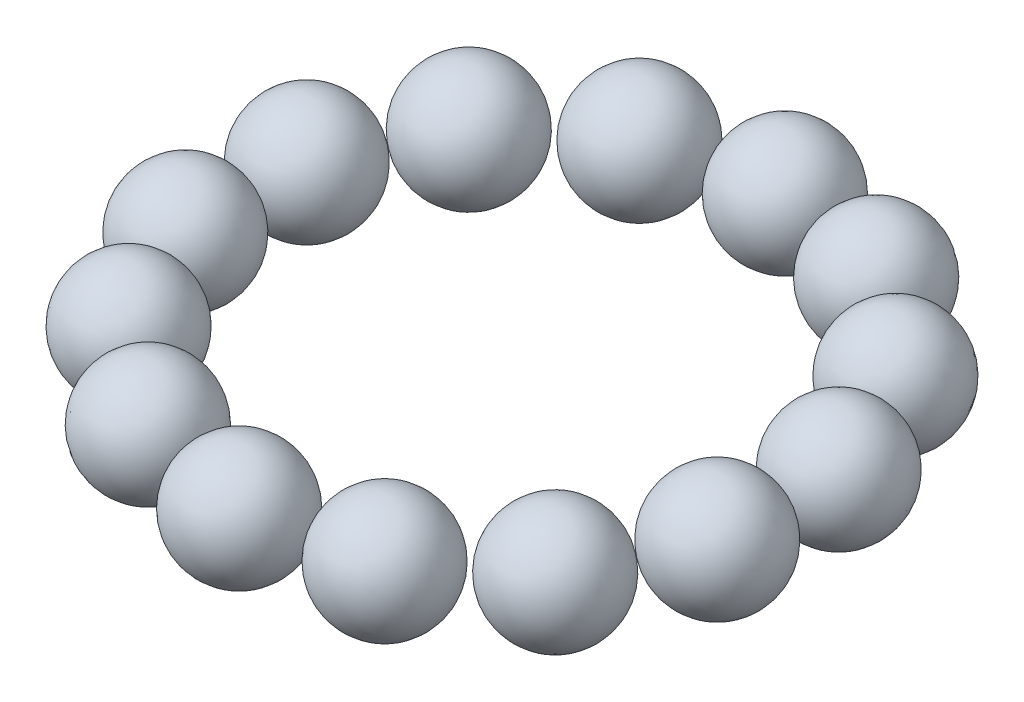
from build123d import *

# Parameters (mm, degrees)
CIRPATTERN2_COUNT = 14


with BuildPart() as part:
    # Sketch2 → Revolve1 (revolve)
    with BuildSketch(Plane.YZ):
        with BuildLine():
            ThreePointArc((3, 14), (0, 17), (-3, 14))
            Line((-3, 14), (3, 14))
        make_face()
    revolve(axis=Axis((0, -3, 14), (0, 1, 0)))


with BuildPart() as cirpattern2_1:
    # CirPattern2: pattern copy
    add(part.part.rotate(Axis((0, -31.815276748, 0), (0, 1, 0)), 1 * 360 / CIRPATTERN2_COUNT))


with BuildPart() as cirpattern2_2:
    # CirPattern2: pattern copy
    add(part.part.rotate(Axis((0, -31.815276748, 0), (0, 1, 0)), 2 * 360 / CIRPATTERN2_COUNT))


with BuildPart() as cirpattern2_3:
    # CirPattern2: pattern copy
    add(part.part.rotate(Axis((0, -31.815276748, 0), (0, 1, 0)), 3 * 360 / CIRPATTERN2_COUNT))


with BuildPart() as cirpattern2_4:
    # CirPattern2: pattern copy
    add(part.part.rotate(Axis((0, -31.815276748, 0), (0, 1, 0)), 4 * 360 / CIRPATTERN2_COUNT))


with BuildPart() as cirpattern2_5:
    # CirPattern2: pattern copy
    add(part.part.rotate(Axis((0, -31.815276748, 0), (0, 1, 0)), 5 * 360 / CIRPATTERN2_COUNT))


with BuildPart() as cirpattern2_6:
    # CirPattern2: pattern copy
    add(part.part.rotate(Axis((0, -31.815276748, 0), (0, 1, 0)), 6 * 360 / CIRPATTERN2_COUNT))


with BuildPart() as cirpattern2_7:
    # CirPattern2: pattern copy
    add(part.part.rotate(Axis((0, -31.815276748, 0), (0, 1, 0)), 7 * 360 / CIRPATTERN2_COUNT))


with BuildPart() as cirpattern2_8:
    # CirPattern2: pattern copy
    add(part.part.rotate(Axis((0, -31.815276748, 0), (0, 1, 0)), 8 * 360 / CIRPATTERN2_COUNT))


with BuildPart() as cirpattern2_9:
    # CirPattern2: pattern copy
    add(part.part.rotate(Axis((0, -31.815276748, 0), (0, 1, 0)), 9 * 360 / CIRPATTERN2_COUNT))


with BuildPart() as cirpattern2_10:
    # CirPattern2: pattern copy
    add(part.part.rotate(Axis((0, -31.815276748, 0), (0, 1, 0)), 10 * 360 / CIRPATTERN2_COUNT))


with BuildPart() as cirpattern2_11:
    # CirPattern2: pattern copy
    add(part.part.rotate(Axis((0, -31.815276748, 0), (0, 1, 0)), 11 * 360 / CIRPATTERN2_COUNT))


with BuildPart() as cirpattern2_12:
    # CirPattern2: pattern copy
    add(part.part.rotate(Axis((0, -31.815276748, 0), (0, 1, 0)), 12 * 360 / CIRPATTERN2_COUNT))


with BuildPart() as cirpattern2_13:
    # CirPattern2: pattern copy
    add(part.part.rotate(Axis((0, -31.815276748, 0), (0, 1, 0)), 13 * 360 / CIRPATTERN2_COUNT))


solid = Compound([part.part, cirpattern2_1.part, cirpattern2_2.part, cirpattern2_3.part, cirpattern2_4.part, cirpattern2_5.part, cirpattern2_6.part, cirpattern2_7.part, cirpattern2_8.part, cirpattern2_9.part, cirpattern2_10.part, cirpattern2_11.part, cirpattern2_12.part, cirpattern2_13.part])
